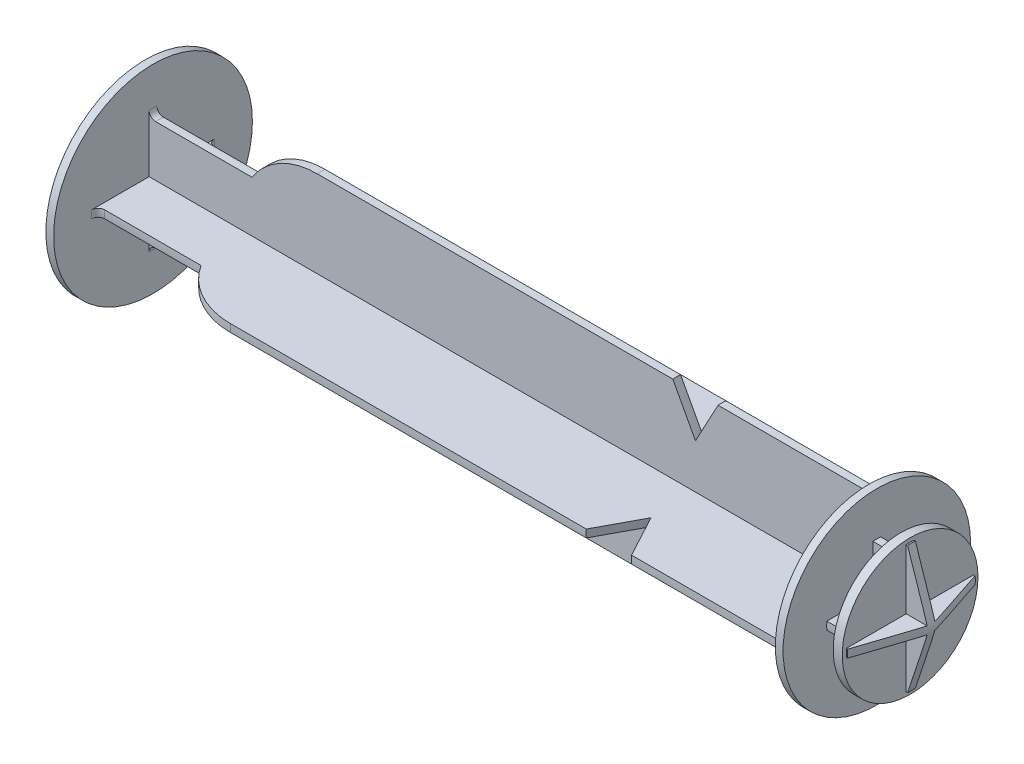
from build123d import *

# Parameters (mm, degrees)
SKETCH2_OUTSIDE_W  = 58.616
SKETCH2_OUTSIDE_H  = 58.616
CUT_EXTRUDE1_DEPTH = 110.75
SKETCH4_OUTSIDE_W  = 58.616
SKETCH4_OUTSIDE_H  = 58.616
CUT_EXTRUDE3_DEPTH = 3.75
SKETCH5_OUTSIDE_W  = 58.616
SKETCH5_OUTSIDE_H  = 58.616
CUT_EXTRUDE4_DEPTH = 3.5


with BuildPart() as part:
    # Sketch1 → Revolve1 (revolve)
    with BuildSketch(Plane.XY, mode=Mode.PRIVATE) as revolve1_sk:
        with BuildLine():
            Line((0, 0), (0, 15.375))
            Line((0, 15.375), (1.2, 15.375))
            Line((1.2, 15.375), (1.2, 9.5))
            ThreePointArc((1.2, 9.5), (1.492893219, 8.792893219), (2.2, 8.5))
            Line((2.2, 8.5), (17.112879499, 8.5))
            ThreePointArc((17.112879499, 8.5), (21.455437353, 12.535653753), (27.2, 14))
            Line((27.2, 14), (82.2, 14))
            Line((82.2, 14), (85.7, 7.5))
            Line((85.7, 7.5), (89.2, 14))
            Line((89.2, 14), (111.95, 14))
            Line((111.95, 14), (111.95, 14.5))
            Line((111.95, 14.5), (113.15, 14.5))
            Line((113.15, 14.5), (113.15, 7.75))
            Line((113.15, 7.75), (116.9, 7.75))
            Line((116.9, 7.75), (116.9, 10.5))
            Line((116.9, 10.5), (118.3, 10.5))
            Line((118.3, 10.5), (121.8, 0))
            Line((121.8, 0), (0, 0))
        make_face()
    revolve(revolve1_sk.sketch.rotate(Axis((121.8, 0, 0), (-1, 0, 0)), 90), axis=Axis((121.8, 0, 0), (-1, 0, 0)))

    # Sketch2 outside → Cut-Extrude1 (cut)
    with BuildSketch(Plane(origin=(1.2, 0, 0), x_dir=(0, 0, -1), z_dir=(1, 0, 0))):
        Rectangle(SKETCH2_OUTSIDE_W, SKETCH2_OUTSIDE_H)
        with BuildLine():
            Line((-0.6, 15.363288222), (-0.6, 0.6))
            Line((-0.6, 0.6), (-15.363288222, 0.6))
            ThreePointArc((-15.363288222, 0.6), (-15.375, 0), (-15.363288222, -0.6))
            Line((-15.363288222, -0.6), (-0.6, -0.6))
            Line((-0.6, -0.6), (-0.6, -15.363288222))
            ThreePointArc((-0.6, -15.363288222), (0, -15.375), (0.6, -15.363288222))
            Line((0.6, -15.363288222), (0.6, -0.6))
            Line((0.6, -0.6), (15.363288222, -0.6))
            ThreePointArc((15.363288222, -0.6), (15.375, 0), (15.363288222, 0.6))
            Line((15.363288222, 0.6), (0.6, 0.6))
            Line((0.6, 0.6), (0.6, 15.363288222))
            ThreePointArc((0.6, 15.363288222), (0, 15.375), (-0.6, 15.363288222))
        make_face(mode=Mode.SUBTRACT)
    extrude(amount=CUT_EXTRUDE1_DEPTH, mode=Mode.SUBTRACT)

    # Sketch4 outside → Cut-Extrude3 (cut)
    with BuildSketch(Plane(origin=(113.15, 0, 0), x_dir=(0, 0, -1), z_dir=(1, 0, 0))):
        Rectangle(SKETCH4_OUTSIDE_W, SKETCH4_OUTSIDE_H)
        with BuildLine():
            Line((0.6, 0.6), (0.6, 15.363288222))
            ThreePointArc((0.6, 15.363288222), (0, 15.375), (-0.6, 15.363288222))
            Line((-0.6, 15.363288222), (-0.6, 0.6))
            Line((-0.6, 0.6), (-15.363288222, 0.6))
            ThreePointArc((-15.363288222, 0.6), (-15.375, 0), (-15.363288222, -0.6))
            Line((-15.363288222, -0.6), (-0.6, -0.6))
            Line((-0.6, -0.6), (-0.6, -15.363288222))
            ThreePointArc((-0.6, -15.363288222), (0, -15.375), (0.6, -15.363288222))
            Line((0.6, -15.363288222), (0.6, -0.6))
            Line((0.6, -0.6), (15.363288222, -0.6))
            ThreePointArc((15.363288222, -0.6), (15.375, 0), (15.363288222, 0.6))
            Line((15.363288222, 0.6), (0.6, 0.6))
        make_face(mode=Mode.SUBTRACT)
    extrude(amount=CUT_EXTRUDE3_DEPTH, mode=Mode.SUBTRACT)

    # Sketch5 outside → Cut-Extrude4 (cut)
    with BuildSketch(Plane(origin=(121.8, 0, 0), x_dir=(0, 0, -1), z_dir=(1, 0, 0))):
        Rectangle(SKETCH5_OUTSIDE_W, SKETCH5_OUTSIDE_H)
        with BuildLine():
            Line((0.6, 0.6), (0.6, 9.856755298))
            ThreePointArc((0.6, 9.856755298), (0, 9.875), (-0.6, 9.856755298))
            Line((-0.6, 9.856755298), (-0.6, 0.6))
            Line((-0.6, 0.6), (-9.856755298, 0.6))
            ThreePointArc((-9.856755298, 0.6), (-9.875, 0), (-9.856755298, -0.6))
            Line((-9.856755298, -0.6), (-0.6, -0.6))
            Line((-0.6, -0.6), (-0.6, -9.856755298))
            ThreePointArc((-0.6, -9.856755298), (0, -9.875), (0.6, -9.856755298))
            Line((0.6, -9.856755298), (0.6, -0.6))
            Line((0.6, -0.6), (9.856755298, -0.6))
            ThreePointArc((9.856755298, -0.6), (9.875, 0), (9.856755298, 0.6))
            Line((9.856755298, 0.6), (0.6, 0.6))
        make_face(mode=Mode.SUBTRACT)
    extrude(amount=-CUT_EXTRUDE4_DEPTH, mode=Mode.SUBTRACT)


solid = part.part
